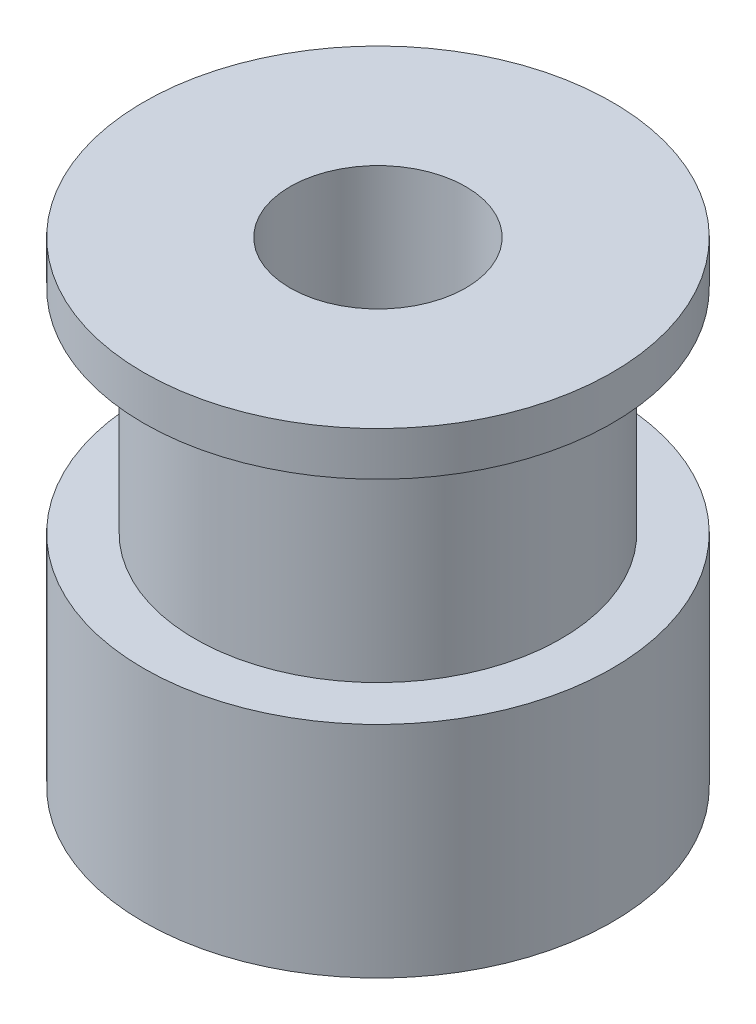
from build123d import *

# Parameters (mm, degrees)
SKETCH1_R           = 8
SKETCH1_R_2         = 3
BOSS_EXTRUDE1_DEPTH = 7.5
SKETCH2_R           = 6.25
SKETCH2_R_2         = 3
BOSS_EXTRUDE2_DEPTH = 7.25
SKETCH3_R           = 8
SKETCH3_R_2         = 3
BOSS_EXTRUDE3_DEPTH = 1.5


with BuildPart() as part:
    # Sketch1 → Boss-Extrude1 (new body)
    with BuildSketch(Plane(origin=(0, 0, 0), x_dir=(1, 0, 0), z_dir=(0, 1, 0))):
        with Locations(Location((0, 0, 0), (0, 0, 270))):
            Circle(SKETCH1_R)
        with Locations(Location((0, 0, 0), (0, 0, 270))):
            Circle(SKETCH1_R_2, mode=Mode.SUBTRACT)
    extrude(amount=BOSS_EXTRUDE1_DEPTH)

    # Sketch2 → Boss-Extrude2 (add)
    with BuildSketch(Plane(origin=(0, 7.5, 0), x_dir=(1, 0, 0), z_dir=(0, 1, 0))):
        with Locations(Location((0, 0, 0), (0, 0, 90))):
            Circle(SKETCH2_R)
        with Locations(Location((0, 0, 0), (0, 0, 270))):
            Circle(SKETCH2_R_2, mode=Mode.SUBTRACT)
    extrude(amount=BOSS_EXTRUDE2_DEPTH)

    # Sketch3 → Boss-Extrude3 (add)
    with BuildSketch(Plane(origin=(0, 14.75, 0), x_dir=(1, 0, 0), z_dir=(0, 1, 0))):
        with Locations(Location((0, 0, 0), (0, 0, 270))):
            Circle(SKETCH3_R)
        with Locations(Location((0, 0, 0), (0, 0, 270))):
            Circle(SKETCH3_R_2, mode=Mode.SUBTRACT)
    extrude(amount=BOSS_EXTRUDE3_DEPTH)


solid = part.part
